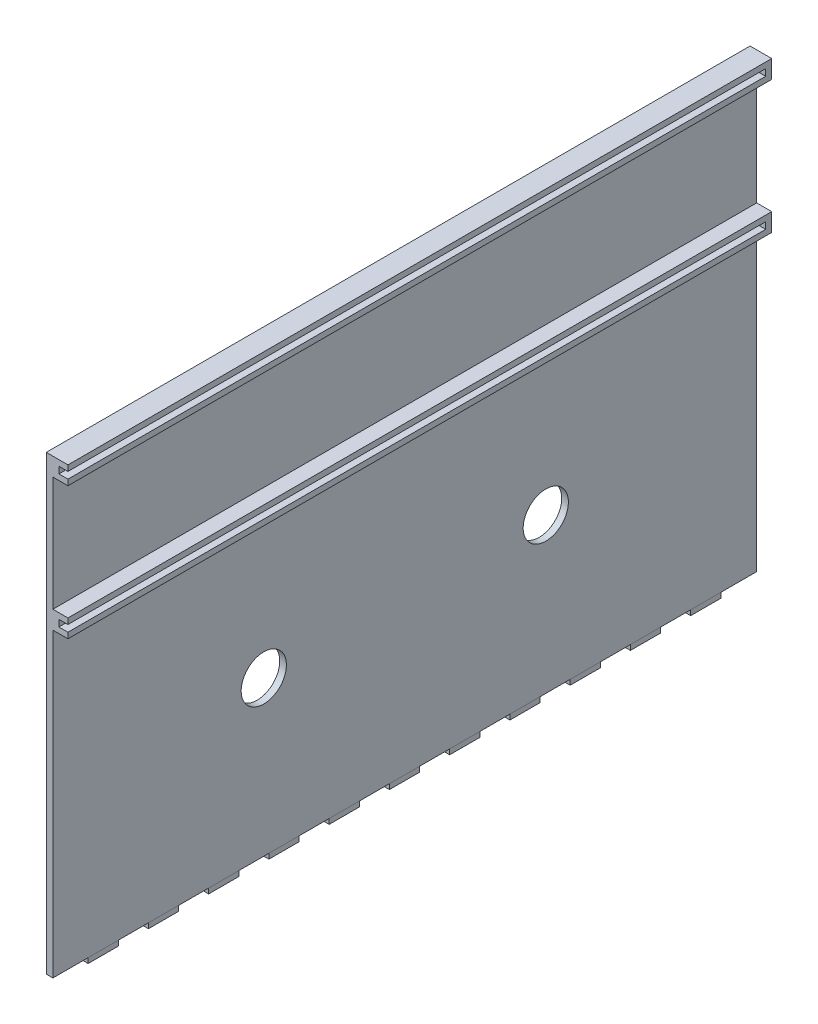
from build123d import *

# Parameters (mm, degrees)
SKETCH_4_W          = 233.6
SKETCH_4_H          = 150
EXTRUDE_2_DEPTH     = 2.2
SKETCH_6_W          = 2
SKETCH_6_H          = 10
EXTRUDE_3_DEPTH     = 1.8
SKETCH_7_W          = 233.6
SKETCH_7_H          = 6
EXTRUDE_4_DEPTH     = 5
SKETCH_8_W          = 114.8
SKETCH_8_H          = 2.2
SKETCH_8_W_2        = 116.8
SKETCH_8_W_3        = 231.6
CUT_EXTRUDE_1_DEPTH = 3
SKETCH1_R           = 7.5
CUT_EXTRUDE1_DEPTH  = 10


with BuildPart() as part:
    # 草图4 → 凸台-拉伸2 (new body)
    with BuildSketch(Plane(origin=(0, 0, 0), x_dir=(0, 0, -1), z_dir=(1, 0, 0))):
        Rectangle(SKETCH_4_W, SKETCH_4_H)
    extrude(amount=EXTRUDE_2_DEPTH)

    # 草图6 → 凸台-拉伸3 (add)
    with BuildSketch(Plane.XZ.offset(75)):
        with Locations((1.1, 20)):
            Rectangle(SKETCH_6_W, SKETCH_6_H)
        with Locations((1.1, 0)):
            Rectangle(SKETCH_6_W, SKETCH_6_H)
        with Locations((1.1, 40)):
            Rectangle(SKETCH_6_W, SKETCH_6_H)
        with Locations((1.1, 60)):
            Rectangle(SKETCH_6_W, SKETCH_6_H)
        with Locations((1.1, 80)):
            Rectangle(SKETCH_6_W, SKETCH_6_H)
        with Locations((1.1, 100)):
            Rectangle(SKETCH_6_W, SKETCH_6_H)
        with Locations((1.1, -20)):
            Rectangle(SKETCH_6_W, SKETCH_6_H)
        with Locations((1.1, -40)):
            Rectangle(SKETCH_6_W, SKETCH_6_H)
        with Locations((1.1, -60)):
            Rectangle(SKETCH_6_W, SKETCH_6_H)
        with Locations((1.1, -80)):
            Rectangle(SKETCH_6_W, SKETCH_6_H)
        with Locations((1.1, -100)):
            Rectangle(SKETCH_6_W, SKETCH_6_H)
    extrude(amount=EXTRUDE_3_DEPTH)

    # 草图7 → 凸台-拉伸4 (add)
    with BuildSketch(Plane(origin=(2.2, 0, 0), x_dir=(0, 0, -1), z_dir=(1, 0, 0))):
        with Locations((0, 28)):
            Rectangle(SKETCH_7_W, SKETCH_7_H)
        with Locations((0, 72)):
            Rectangle(SKETCH_7_W, SKETCH_7_H)
    extrude(amount=EXTRUDE_4_DEPTH)

    # 草图8 → 切除-拉伸1 (cut)
    with BuildSketch(Plane(origin=(7.2, 0, 0), x_dir=(0, 0, -1), z_dir=(1, 0, 0))):
        with Locations((57.4, 28)):
            Rectangle(SKETCH_8_W, SKETCH_8_H)
        with Locations((-58.4, 28)):
            Rectangle(SKETCH_8_W_2, SKETCH_8_H)
        with Locations((-1, 72)):
            Rectangle(SKETCH_8_W_3, SKETCH_8_H)
    extrude(amount=-CUT_EXTRUDE_1_DEPTH, mode=Mode.SUBTRACT)

    # Sketch1 → Cut-Extrude1 (cut)
    with BuildSketch(Plane(origin=(2.2, 0, 0), x_dir=(0, 0, -1), z_dir=(1, 0, 0))):
        with Locations((-46.8, -23.745319948)):
            Circle(SKETCH1_R)
        with Locations((46.8, -23.745319948)):
            Circle(SKETCH1_R)
    extrude(amount=-CUT_EXTRUDE1_DEPTH, mode=Mode.SUBTRACT)


solid = part.part
